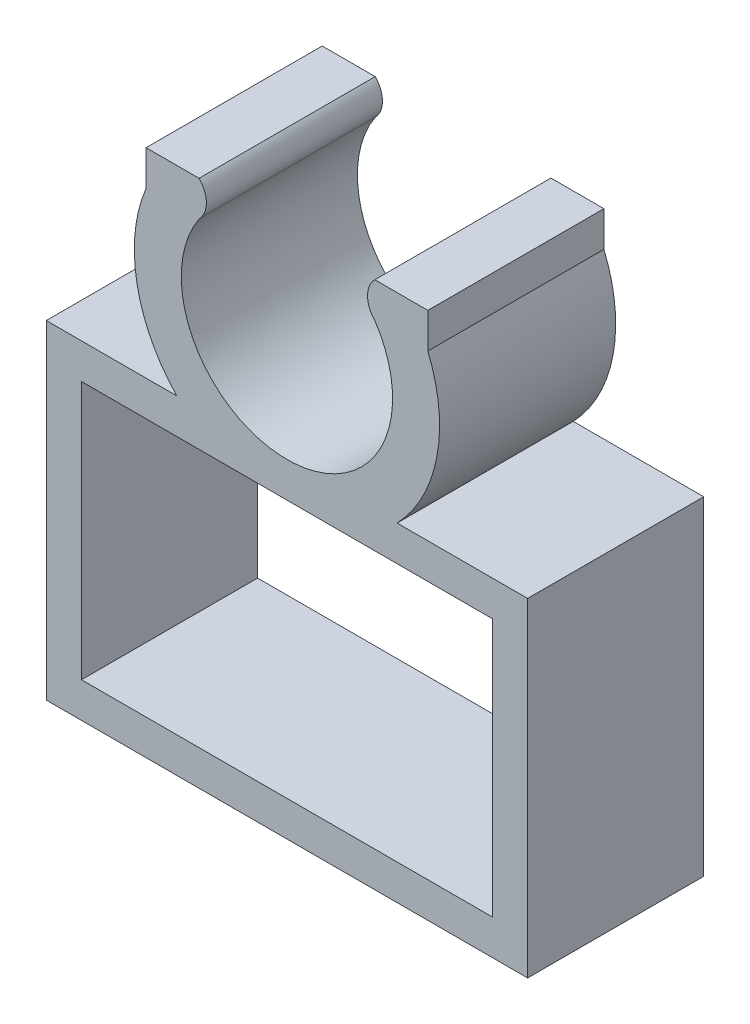
from build123d import *

# Parameters (mm, degrees)
CROQUIS1_W              = 35
CROQUIS1_H              = 22
SALIENTE_EXTRUIR1_DEPTH = 15


with BuildPart() as part:
    # Croquis1 → Saliente-Extruir1 (new body)
    with BuildSketch(Plane.XY):
        with BuildLine():
            Line((-69.45710358, 8.218313922), (-69.45710358, -19.781686078))
            Line((-69.45710358, -19.781686078), (-28.45710358, -19.781686078))
            Line((-28.45710358, -19.781686078), (-28.45710358, 8.218313922))
            Line((-28.45710358, 8.218313922), (-39.57627206, 8.218313922))
            ThreePointArc((-39.57627206, 8.218313922), (-36.178802084, 14.827705029), (-36.95710358, 22.218313922))
            Line((-36.95710358, 22.218313922), (-36.95710358, 25.218313922))
            Line((-36.95710358, 25.218313922), (-41.473788806, 25.218313922))
            ThreePointArc((-41.473788806, 25.218313922), (-42.09510915, 23.718313922), (-41.473788806, 22.218313922))
            ThreePointArc((-41.473788806, 22.218313922), (-48.95710358, 8.218313922), (-56.440418353, 22.218313922))
            ThreePointArc((-56.440418353, 22.218313922), (-55.81909801, 23.718313922), (-56.440418353, 25.218313922))
            Line((-56.440418353, 25.218313922), (-60.95710358, 25.218313922))
            Line((-60.95710358, 25.218313922), (-60.95710358, 22.218313922))
            ThreePointArc((-60.95710358, 22.218313922), (-61.735405076, 14.827705029), (-58.3379351, 8.218313922))
            Line((-58.3379351, 8.218313922), (-69.45710358, 8.218313922))
        make_face()
        with Locations((-48.95710358, -5.781686078)):
            Rectangle(CROQUIS1_W, CROQUIS1_H, mode=Mode.SUBTRACT)
    extrude(amount=SALIENTE_EXTRUIR1_DEPTH)


solid = part.part
